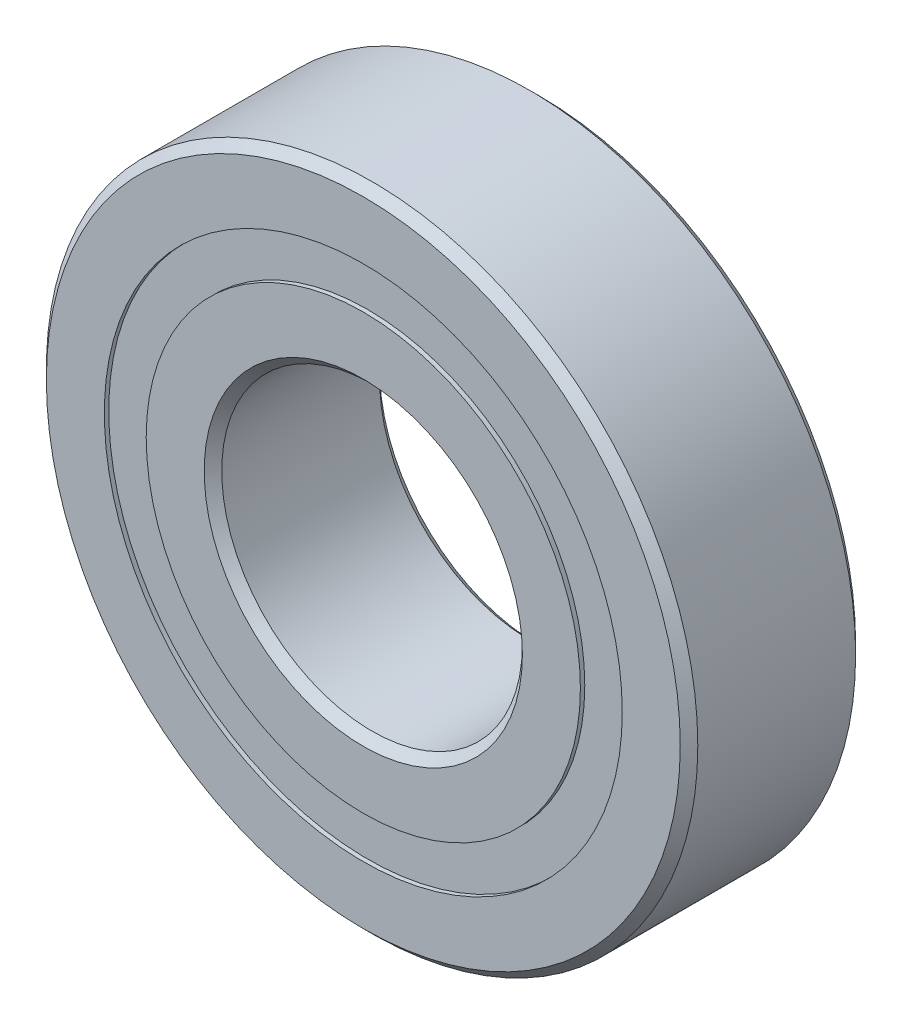
from build123d import *

# Parameters (mm, degrees)
CIRPATTERN1_COUNT = 12
SKETCH5_W         = 2.475587948
SKETCH5_H         = 2.651648352


with BuildPart() as part:
    # Sketch1 → Revolve1 (revolve)
    with BuildSketch(Plane(origin=(0, 0, 0), x_dir=(0, 0, -1), z_dir=(1, 0, 0)), mode=Mode.PRIVATE) as revolve1_sk:
        with BuildLine():
            Line((5.000625, 20.6375), (-5.000625, 20.6375))
            Line((-5.000625, 20.6375), (-5.55625, 20.081875))
            Line((-5.55625, 20.081875), (-5.55625, 16.407074176))
            Line((-5.55625, 16.407074176), (-2.469444444, 16.407074176))
            ThreePointArc((-2.469444444, 16.407074176), (0, 17.884099552), (2.469444444, 16.407074176))
            Line((2.469444444, 16.407074176), (5.55625, 16.407074176))
            Line((5.55625, 16.407074176), (5.55625, 20.081875))
            Line((5.55625, 20.081875), (5.000625, 20.6375))
        make_face()
    revolve(revolve1_sk.sketch.rotate(Axis((0, 0, 5.55625), (0, 0, -1)), 90), axis=Axis((0, 0, 5.55625), (0, 0, -1)))


with BuildPart() as body_2:
    # Sketch3 → Revolve3 (revolve)
    with BuildSketch(Plane(origin=(0, 0, 0), x_dir=(0, 0, -1), z_dir=(1, 0, 0)), mode=Mode.PRIVATE) as revolve3_sk:
        with BuildLine():
            Line((-5.55625, 13.755425824), (-2.469444444, 13.755425824))
            ThreePointArc((-2.469444444, 13.755425824), (0, 12.278400448), (2.469444444, 13.755425824))
            Line((2.469444444, 13.755425824), (5.55625, 13.755425824))
            Line((5.55625, 13.755425824), (5.55625, 10.080625))
            Line((5.55625, 10.080625), (5.000625, 9.525))
            Line((5.000625, 9.525), (-5.000625, 9.525))
            Line((-5.000625, 9.525), (-5.55625, 10.080625))
            Line((-5.55625, 10.080625), (-5.55625, 13.755425824))
        make_face()
    revolve(revolve3_sk.sketch.rotate(Axis((0, 0, 5.55625), (0, 0, -1)), 90), axis=Axis((0, 0, 5.55625), (0, 0, -1)))


with BuildPart() as body_3:
    # Sketch4 → Revolve4 (revolve)
    with BuildSketch(Plane(origin=(0, 0, 0), x_dir=(0, 0, -1), z_dir=(1, 0, 0))):
        with BuildLine():
            Line((-2.802849552, 15.08125), (2.802849552, 15.08125))
            ThreePointArc((2.802849552, 15.08125), (0, 17.884099552), (-2.802849552, 15.08125))
        make_face()
    revolve(axis=Axis((0, 15.08125, 2.802849552), (0, 0, -1)))


with BuildPart() as cirpattern1_1:
    # CirPattern1: pattern copy
    add(body_3.part.rotate(Axis((0, 0, 0), (0, 0, 1)), 1 * 360 / CIRPATTERN1_COUNT))


with BuildPart() as cirpattern1_2:
    # CirPattern1: pattern copy
    add(body_3.part.rotate(Axis((0, 0, 0), (0, 0, 1)), 2 * 360 / CIRPATTERN1_COUNT))


with BuildPart() as cirpattern1_3:
    # CirPattern1: pattern copy
    add(body_3.part.rotate(Axis((0, 0, 0), (0, 0, 1)), 3 * 360 / CIRPATTERN1_COUNT))


with BuildPart() as cirpattern1_4:
    # CirPattern1: pattern copy
    add(body_3.part.rotate(Axis((0, 0, 0), (0, 0, 1)), 4 * 360 / CIRPATTERN1_COUNT))


with BuildPart() as cirpattern1_5:
    # CirPattern1: pattern copy
    add(body_3.part.rotate(Axis((0, 0, 0), (0, 0, 1)), 5 * 360 / CIRPATTERN1_COUNT))


with BuildPart() as cirpattern1_6:
    # CirPattern1: pattern copy
    add(body_3.part.rotate(Axis((0, 0, 0), (0, 0, 1)), 6 * 360 / CIRPATTERN1_COUNT))


with BuildPart() as cirpattern1_7:
    # CirPattern1: pattern copy
    add(body_3.part.rotate(Axis((0, 0, 0), (0, 0, 1)), 7 * 360 / CIRPATTERN1_COUNT))


with BuildPart() as cirpattern1_8:
    # CirPattern1: pattern copy
    add(body_3.part.rotate(Axis((0, 0, 0), (0, 0, 1)), 8 * 360 / CIRPATTERN1_COUNT))


with BuildPart() as cirpattern1_9:
    # CirPattern1: pattern copy
    add(body_3.part.rotate(Axis((0, 0, 0), (0, 0, 1)), 9 * 360 / CIRPATTERN1_COUNT))


with BuildPart() as cirpattern1_10:
    # CirPattern1: pattern copy
    add(body_3.part.rotate(Axis((0, 0, 0), (0, 0, 1)), 10 * 360 / CIRPATTERN1_COUNT))


with BuildPart() as cirpattern1_11:
    # CirPattern1: pattern copy
    add(body_3.part.rotate(Axis((0, 0, 0), (0, 0, 1)), 11 * 360 / CIRPATTERN1_COUNT))


with BuildPart() as body_15:
    # Sketch5 → Revolve5 (revolve)
    with BuildSketch(Plane(origin=(0, 0, 0), x_dir=(0, 0, -1), z_dir=(1, 0, 0)), mode=Mode.PRIVATE) as revolve5_sk:
        with Locations((-4.040643526, 15.08125)):
            Rectangle(SKETCH5_W, SKETCH5_H)
        with Locations((4.040643526, 15.08125)):
            Rectangle(SKETCH5_W, SKETCH5_H)
    revolve(revolve5_sk.sketch.rotate(Axis((0, 0, 5.55625), (0, 0, -1)), 90), axis=Axis((0, 0, 5.55625), (0, 0, -1)))


solid = Compound([part.part, body_2.part, body_3.part, cirpattern1_1.part, cirpattern1_2.part, cirpattern1_3.part, cirpattern1_4.part, cirpattern1_5.part, cirpattern1_6.part, cirpattern1_7.part, cirpattern1_8.part, cirpattern1_9.part, cirpattern1_10.part, cirpattern1_11.part, body_15.part])
